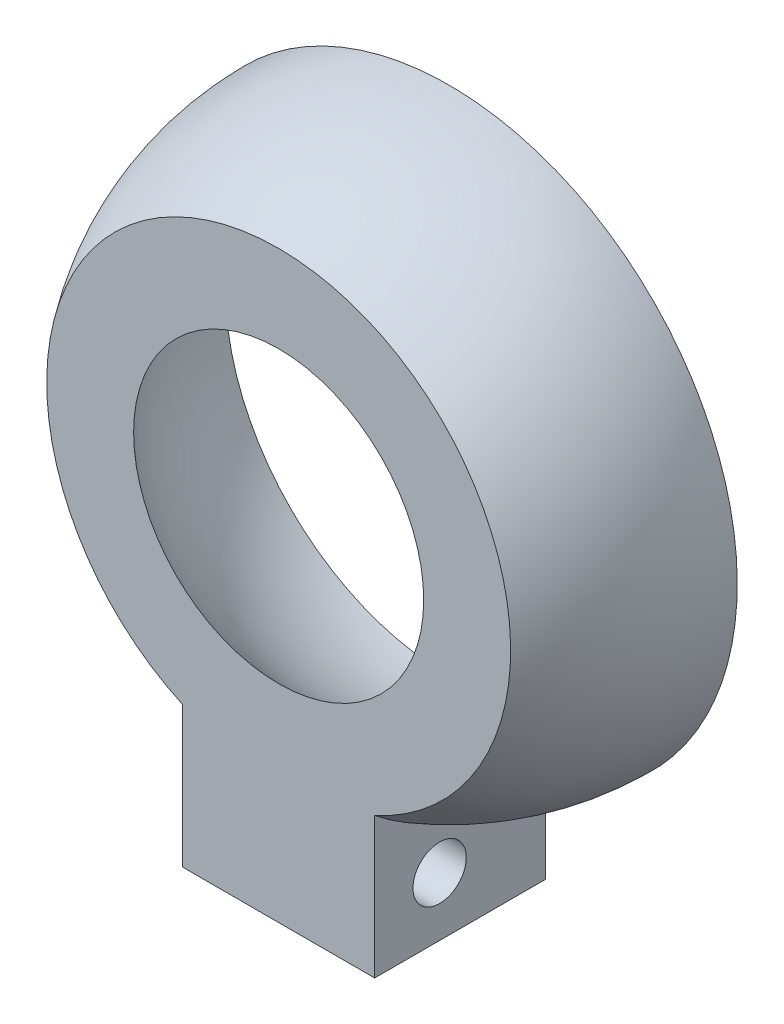
from build123d import *

# Parameters (mm, degrees)
SKETCH4_W                = 9
SKETCH4_H                = 8
BASEBOSS_DEPTH           = 3
BOSS_EXTRUDE3_REACH      = 37.383
BOSS_EXTRUDE3_END_RADIUS = 13.5
SKETCH4_5_W              = 9
SKETCH4_5_H              = 8
CUT_EXTRUDE2_REACH       = 94.415
SKETCH7_R                = 1.25


with BuildPart() as part:
    # Sketch4 → BaseBoss (new body)
    with BuildSketch(Plane(origin=(0, 60.25, 0), x_dir=(1, 0, 0), z_dir=(0, 1, 0))):
        with Locations((-3.25, 4.451253904)):
            Rectangle(SKETCH4_W, SKETCH4_H)
    extrude(amount=BASEBOSS_DEPTH)



with BuildPart() as body_2:
    # Sketch5 → CoverRevolve (revolve)
    with BuildSketch(Plane.ZY.offset(3.25), mode=Mode.PRIVATE) as coverrevolve_sk:
        with BuildLine():
            Line((-8.451253904, 63.25), (-8.451253904, 66.25))
            ThreePointArc((-8.451253904, 66.25), (-4.044311663, 67.219582376), (-0.451253904, 69.949264746))
            Line((-0.451253904, 69.949264746), (-0.451253904, 65.875718415))
            ThreePointArc((-0.451253904, 65.875718415), (-4.24131337, 63.923215496), (-8.451253904, 63.25))
        make_face()
    revolve(coverrevolve_sk.sketch.rotate(Axis((-3.25, 76.75, -0.451253904), (0, 0, -1)), 270), axis=Axis((-3.25, 76.75, -0.451253904), (0, 0, -1)))


with BuildPart() as part_1:
    add(part.part)

    add(body_2.part)  # Boss-Extrude3 merges body 2
    # Boss-Extrude3: up to this sphere (the profile starts outside it)
    boss_extrude3_end = Location((-3.25, 76.75, -8.451253904)) * Sphere(BOSS_EXTRUDE3_END_RADIUS, mode=Mode.PRIVATE)
    # Sketch4<5> → Boss-Extrude3 (add, up to the surface)
    with BuildSketch(Plane(origin=(0, 60.25, 0), x_dir=(1, 0, 0), z_dir=(0, 1, 0)), mode=Mode.PRIVATE) as boss_extrude3_sk1:
        with Locations((-3.25, 4.451253904)):
            Rectangle(SKETCH4_5_W, SKETCH4_5_H)
    boss_extrude3_tool1 = extrude(boss_extrude3_sk1.sketch, amount=BOSS_EXTRUDE3_REACH, mode=Mode.PRIVATE) - boss_extrude3_end
    add(boss_extrude3_tool1.solids().sort_by_distance((-3.25, 60.25, -4.451254))[0])

    # Sketch7 → Cut-Extrude2 (cut, up to next)
    with BuildSketch(Plane(origin=(1.25, 0, 0), x_dir=(0, 0, -1), z_dir=(1, 0, 0)), mode=Mode.PRIVATE) as cut_extrude2_sk1:
        with Locations((3.496708449, 63)):
            Circle(SKETCH7_R)
    cut_extrude2_tool1 = extrude(cut_extrude2_sk1.sketch, amount=-CUT_EXTRUDE2_REACH, mode=Mode.PRIVATE) & part_1.part
    add(cut_extrude2_tool1.solids().sort_by_distance((1.25, 63, -3.496708))[0], mode=Mode.SUBTRACT)


solid = part_1.part
